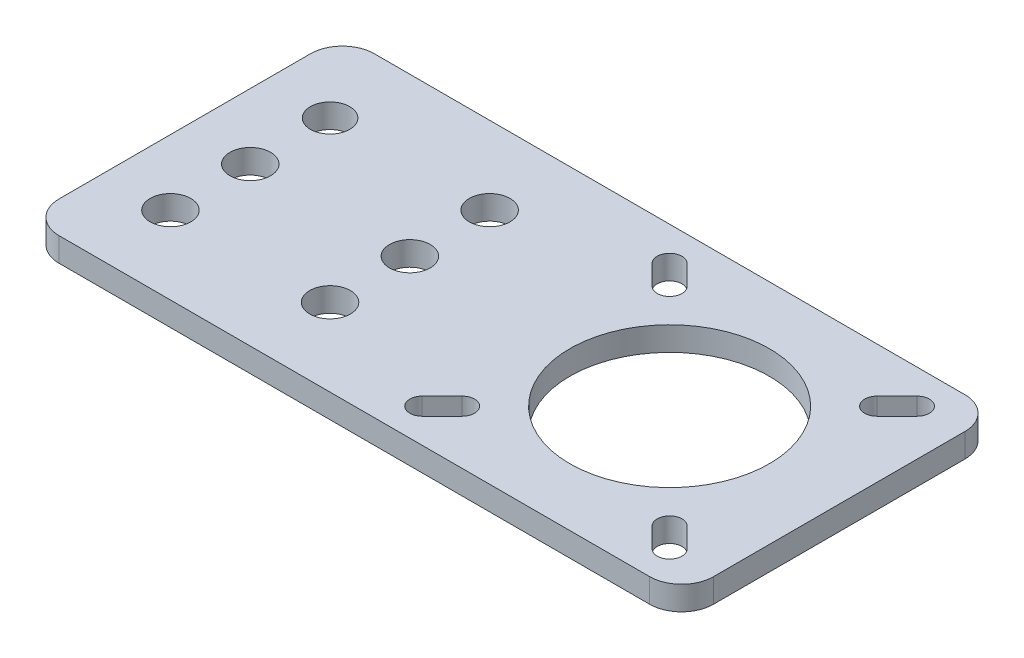
from build123d import *

# Parameters (mm, degrees)
SKETCH1_R           = 12.5
SKETCH1_R_2         = 2.55
SKETCH1_R_3         = 2.466704156
BOSS_EXTRUDE1_DEPTH = 3


with BuildPart() as part:
    # Sketch1 → Boss-Extrude1 (new body)
    with BuildSketch(Plane(origin=(0, 0, 0), x_dir=(1, 0, 0), z_dir=(0, 1, 0))):
        with BuildLine():
            Line((-16.913823097, 28.881843054), (57.086176903, 28.881843054))
            ThreePointArc((57.086176903, 28.881843054), (59.914604028, 27.710270179), (61.086176903, 24.881843054))
            Line((61.086176903, 24.881843054), (61.086176903, -6.618156946))
            ThreePointArc((61.086176903, -6.618156946), (59.914604028, -9.44658407), (57.086176903, -10.618156946))
            Line((57.086176903, -10.618156946), (-16.913823097, -10.618156946))
            ThreePointArc((-16.913823097, -10.618156946), (-19.742250221, -9.44658407), (-20.913823097, -6.618156946))
            Line((-20.913823097, -6.618156946), (-20.913823097, 24.881843054))
            ThreePointArc((-20.913823097, 24.881843054), (-19.742250221, 27.710270179), (-16.913823097, 28.881843054))
        make_face()
        with Locations(Location((39.836176903, 9.131843054, 0), (0, 0, 270))):
            Circle(SKETCH1_R, mode=Mode.SUBTRACT)
        with Locations(Location((7.286176903, 19.131843054, 0), (0, 0, 270))):
            Circle(SKETCH1_R_2, mode=Mode.SUBTRACT)
        with Locations(Location((-12.713823097, 19.131843054, 0), (0, 0, 270))):
            Circle(SKETCH1_R_3, mode=Mode.SUBTRACT)
        with Locations(Location((-12.713823097, 9.131843054, 0), (0, 0, 270))):
            Circle(SKETCH1_R_2, mode=Mode.SUBTRACT)
        with Locations(Location((7.286176903, 9.131843054, 0), (0, 0, 270))):
            Circle(SKETCH1_R_2, mode=Mode.SUBTRACT)
        with Locations(Location((-12.713823097, -0.868156946, 0), (0, 0, 270))):
            Circle(SKETCH1_R_2, mode=Mode.SUBTRACT)
        with Locations(Location((7.286176903, -0.868156946, 0), (0, 0, 270))):
            Circle(SKETCH1_R_2, mode=Mode.SUBTRACT)
        with BuildLine():
            Line((56.432192414, 23.535827543), (53.932192414, 21.035827543))
            ThreePointArc((53.932192414, 21.035827543), (51.740161393, 21.035827543), (51.740161393, 23.227858565))
            Line((51.740161393, 23.227858565), (54.240161393, 25.727858565))
            ThreePointArc((54.240161393, 25.727858565), (56.432192414, 25.727858565), (56.432192414, 23.535827543))
        make_face(mode=Mode.SUBTRACT)
        with BuildLine():
            Line((56.432192414, -5.272141435), (53.932192414, -2.772141435))
            ThreePointArc((53.932192414, -2.772141435), (51.740161393, -2.772141435), (51.740161393, -4.964172457))
            Line((51.740161393, -4.964172457), (54.240161393, -7.464172457))
            ThreePointArc((54.240161393, -7.464172457), (56.432192414, -7.464172457), (56.432192414, -5.272141435))
        make_face(mode=Mode.SUBTRACT)
        with BuildLine():
            Line((25.432192414, -7.464172457), (27.932192414, -4.964172457))
            ThreePointArc((27.932192414, -4.964172457), (27.932192414, -2.772141435), (25.740161393, -2.772141435))
            Line((25.740161393, -2.772141435), (23.240161393, -5.272141435))
            ThreePointArc((23.240161393, -5.272141435), (23.240161393, -7.464172457), (25.432192414, -7.464172457))
        make_face(mode=Mode.SUBTRACT)
        with BuildLine():
            Line((23.240161393, 23.535827543), (25.740161393, 21.035827543))
            ThreePointArc((25.740161393, 21.035827543), (27.932192414, 21.035827543), (27.932192414, 23.227858565))
            Line((27.932192414, 23.227858565), (25.432192414, 25.727858565))
            ThreePointArc((25.432192414, 25.727858565), (23.240161393, 25.727858565), (23.240161393, 23.535827543))
        make_face(mode=Mode.SUBTRACT)
    extrude(amount=BOSS_EXTRUDE1_DEPTH)


solid = part.part
